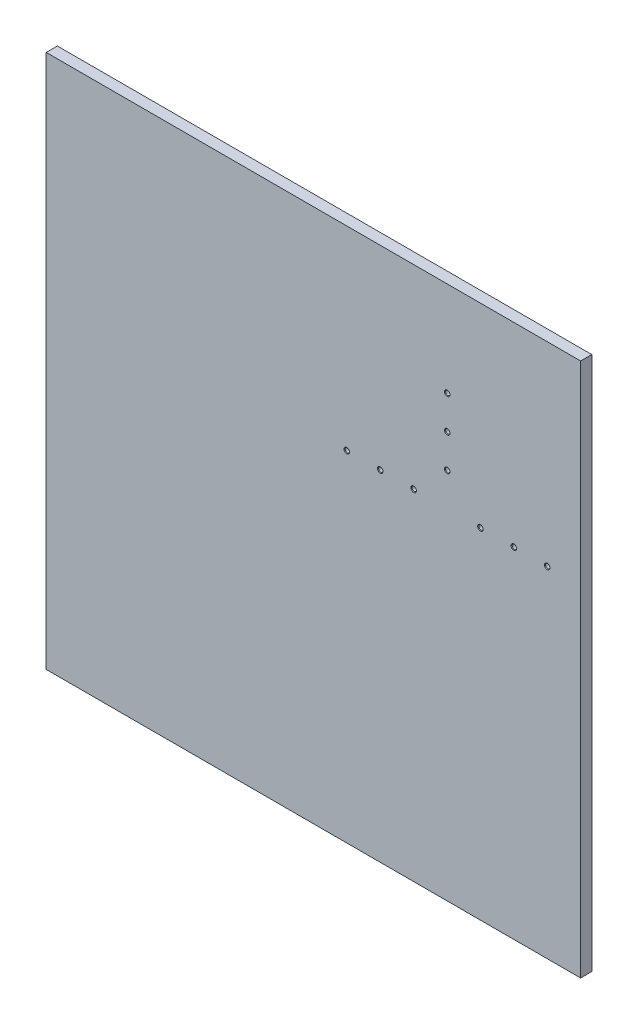
from build123d import *

# Parameters (mm, degrees)
SKETCH1_W                            = 304.8
SKETCH1_H                            = 304.8
BOSS_EXTRUDE1_DEPTH                  = 12.7
SKETCH2_W                            = 12.7
SKETCH2_H                            = 304.8
BOSS_EXTRUDE2_DEPTH                  = 304.8
SKETCH3_W                            = 609.6
SKETCH3_H                            = 12.7
BOSS_EXTRUDE3_DEPTH                  = 254
SKETCH4_W                            = 609.6
SKETCH4_H                            = 12.7
BOSS_EXTRUDE4_DEPTH                  = 50.8
F_8_0_199_DIAMETER_HOLE2_D           = 5.0546
F_8_0_199_DIAMETER_HOLE2_DEPTH       = 8.382
F_8_0_199_DIAMETER_HOLE2_CSINK_D     = 6.3246
F_8_0_199_DIAMETER_HOLE2_CSINK_ANGLE = 90
F_8_0_199_DIAMETER_HOLE2_TIP         = 1.518555042


with BuildPart() as part:
    # Sketch1 → Boss-Extrude1 (new body)
    with BuildSketch(Plane.XY):
        with Locations((-60.739130435, 60.186956522)):
            Rectangle(SKETCH1_W, SKETCH1_H)
    extrude(amount=BOSS_EXTRUDE1_DEPTH)

    # Sketch2 → Boss-Extrude2 (add)
    with BuildSketch(Plane.ZY.offset(213.139130435)):
        with Locations((6.35, 60.186956522)):
            Rectangle(SKETCH2_W, SKETCH2_H)
    extrude(amount=BOSS_EXTRUDE2_DEPTH)

    # Sketch3 → Boss-Extrude3 (add)
    with BuildSketch(Plane.XZ.offset(92.213043478)):
        with Locations((-213.139130435, 6.35)):
            Rectangle(SKETCH3_W, SKETCH3_H)
    extrude(amount=BOSS_EXTRUDE3_DEPTH)

    # Sketch4 → Boss-Extrude4 (add)
    with BuildSketch(Plane(origin=(0, 212.586956522, 0), x_dir=(1, 0, 0), z_dir=(0, 1, 0))):
        with Locations((-213.139130435, -6.35)):
            Rectangle(SKETCH4_W, SKETCH4_H)
    extrude(amount=BOSS_EXTRUDE4_DEPTH)

    # #8 (0.199) Diameter Hole2
    with Locations(Plane.XY.offset(12.7)):
        with Locations((53.560869565, 41.390956522), (15.460869565, 41.390956522), (-22.639130435, 41.390956522), (-98.839130435, 41.390956522), (-136.939130435, 41.390956522), (-175.039130435, 41.390956522), (-60.485130435, 79.236956522), (-60.485130435, 117.336956522), (-60.485130435, 155.436956522)):
            CounterSinkHole(F_8_0_199_DIAMETER_HOLE2_D / 2, F_8_0_199_DIAMETER_HOLE2_CSINK_D / 2, depth=F_8_0_199_DIAMETER_HOLE2_DEPTH, counter_sink_angle=F_8_0_199_DIAMETER_HOLE2_CSINK_ANGLE)
            with Locations((0, 0, -(F_8_0_199_DIAMETER_HOLE2_DEPTH + F_8_0_199_DIAMETER_HOLE2_TIP / 2))):  # 118° drill point
                Cone(0, F_8_0_199_DIAMETER_HOLE2_D / 2, F_8_0_199_DIAMETER_HOLE2_TIP, mode=Mode.SUBTRACT)


solid = part.part
